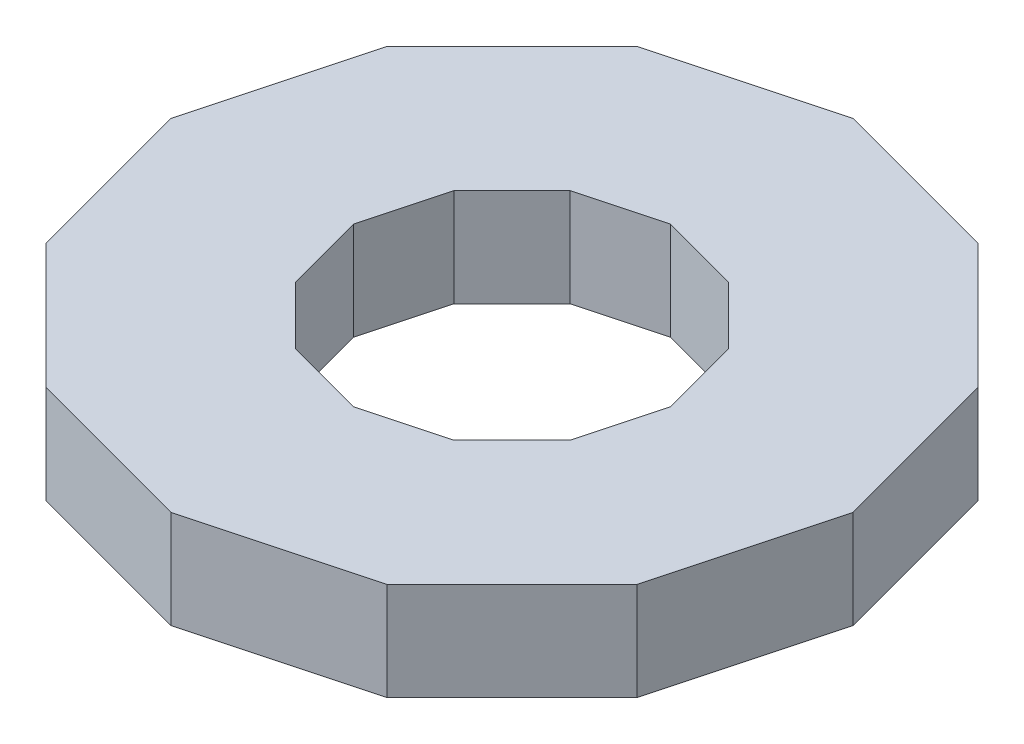
from build123d import *

# Parameters (mm, degrees)
BOSS_EXTRUDE1_DEPTH = 19.05


with BuildPart() as part:
    # Sketch1 → Boss-Extrude1 (new body)
    with BuildSketch(Plane(origin=(0, 0, 0), x_dir=(1, 0, 0), z_dir=(0, 1, 0))):
        Polygon((66.243193167, 0), (57.36828811, 33.121596583), (33.121596583, 57.36828811), (0, 66.243193167), (-33.121596583, 57.36828811), (-57.36828811, 33.121596583), (-66.243193167, 0), (-57.36828811, -33.121596583), (-33.121596583, -57.36828811), (0, -66.243193167), (33.121596583, -57.36828811), (57.36828811, -33.121596583), align=None)
        Polygon((30.743572941, 0), (26.62471517, 15.37178647), (15.37178647, 26.62471517), (0, 30.743572941), (-15.37178647, 26.62471517), (-26.62471517, 15.37178647), (-30.743572941, 0), (-26.62471517, -15.37178647), (-15.37178647, -26.62471517), (0, -30.743572941), (15.37178647, -26.62471517), (26.62471517, -15.37178647), align=None, mode=Mode.SUBTRACT)
    extrude(amount=BOSS_EXTRUDE1_DEPTH)


solid = part.part
